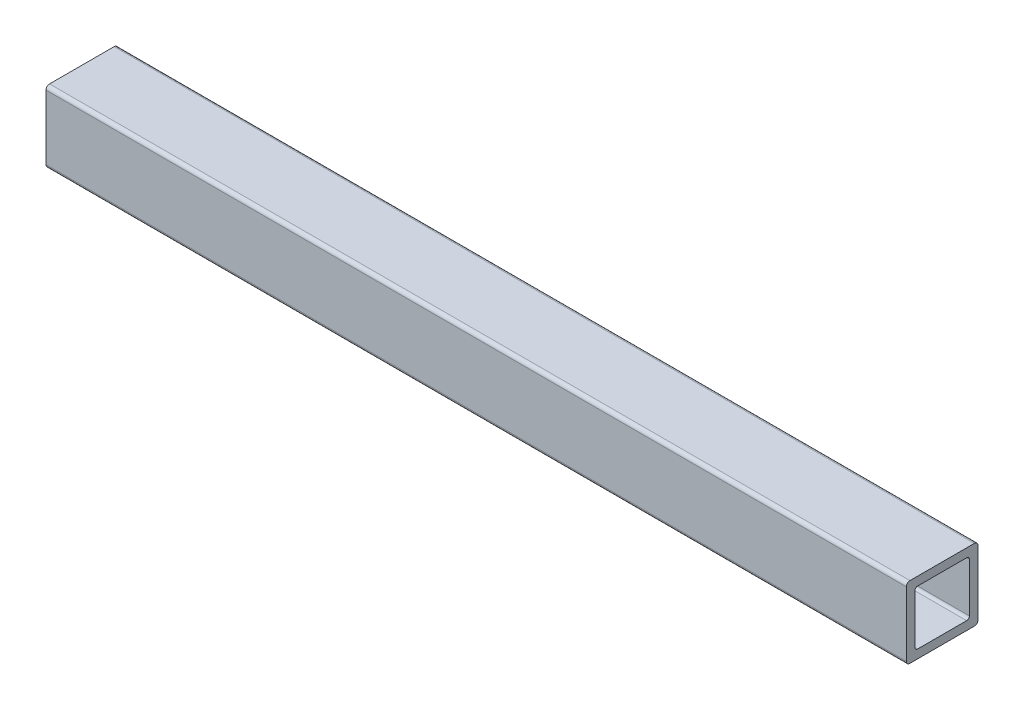
from build123d import *

# Parameters (mm, degrees)
BOSS_EXTRUDE1_DEPTH      = 152.4
BOSS_EXTRUDE1_DEPTH_BACK = 152.4


with BuildPart() as part:
    # Sketch4 → Boss-Extrude1 (new, two sides: drawn at the far end of the back side and taken through both)
    with BuildSketch(Plane(origin=(0, 0, 0), x_dir=(0, 0, -1), z_dir=(1, 0, 0)).offset(-BOSS_EXTRUDE1_DEPTH_BACK)):
        with BuildLine():
            Line((12.7, -11.43), (12.7, 11.43))
            ThreePointArc((12.7, 11.43), (12.328025612, 12.328025612), (11.43, 12.7))
            Line((11.43, 12.7), (-11.43, 12.7))
            ThreePointArc((-11.43, 12.7), (-12.328025612, 12.328025612), (-12.7, 11.43))
            Line((-12.7, 11.43), (-12.7, -11.43))
            ThreePointArc((-12.7, -11.43), (-12.328025612, -12.328025612), (-11.43, -12.7))
            Line((-11.43, -12.7), (11.43, -12.7))
            ThreePointArc((11.43, -12.7), (12.328025612, -12.328025612), (12.7, -11.43))
        make_face()
        with BuildLine():
            Line((9.652, 8.6868), (9.652, -8.6868))
            ThreePointArc((9.652, -8.6868), (9.369299465, -9.369299465), (8.6868, -9.652))
            Line((8.6868, -9.652), (-8.6868, -9.652))
            ThreePointArc((-8.6868, -9.652), (-9.369299465, -9.369299465), (-9.652, -8.6868))
            Line((-9.652, -8.6868), (-9.652, 8.6868))
            ThreePointArc((-9.652, 8.6868), (-9.369299465, 9.369299465), (-8.6868, 9.652))
            Line((-8.6868, 9.652), (8.6868, 9.652))
            ThreePointArc((8.6868, 9.652), (9.369299465, 9.369299465), (9.652, 8.6868))
        make_face(mode=Mode.SUBTRACT)
    extrude(amount=BOSS_EXTRUDE1_DEPTH + BOSS_EXTRUDE1_DEPTH_BACK)


solid = part.part
